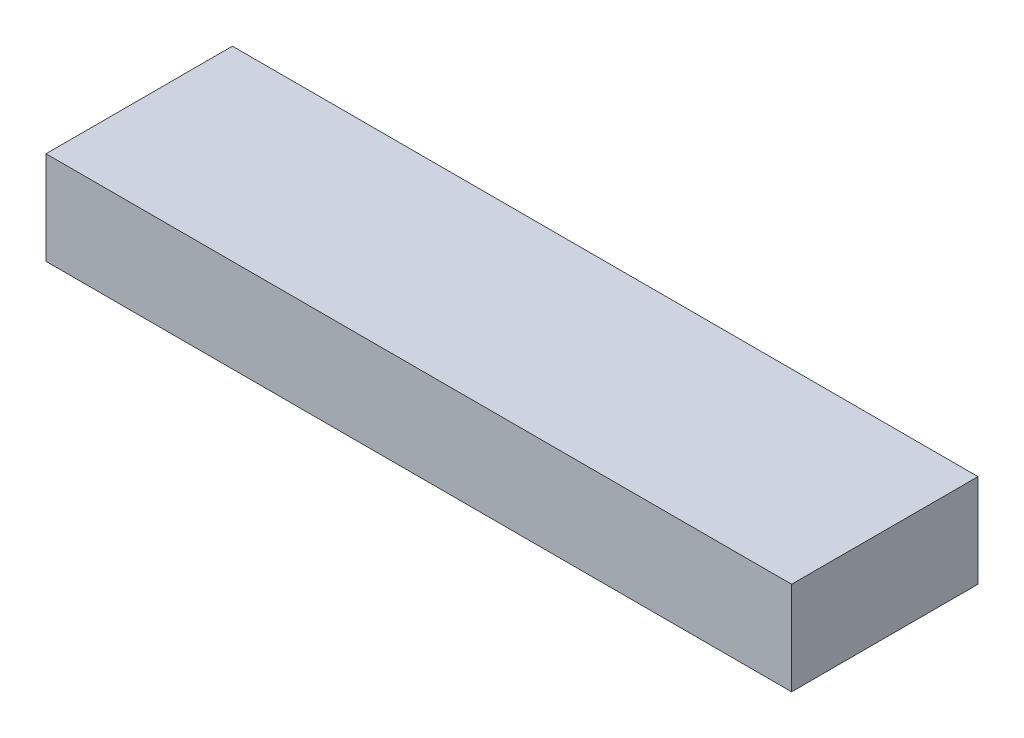
from build123d import *

# Parameters (mm, degrees)
SKETCH1_W           = 120
SKETCH1_H           = 30
BOSS_EXTRUDE1_DEPTH = 15


with BuildPart() as part:
    # Sketch1 → Boss-Extrude1 (new body)
    with BuildSketch(Plane(origin=(0, 0, 0), x_dir=(1, 0, 0), z_dir=(0, 1, 0))):
        with Locations((-14.57752877, 2.952755906)):
            Rectangle(SKETCH1_W, SKETCH1_H)
    extrude(amount=BOSS_EXTRUDE1_DEPTH)


solid = part.part
